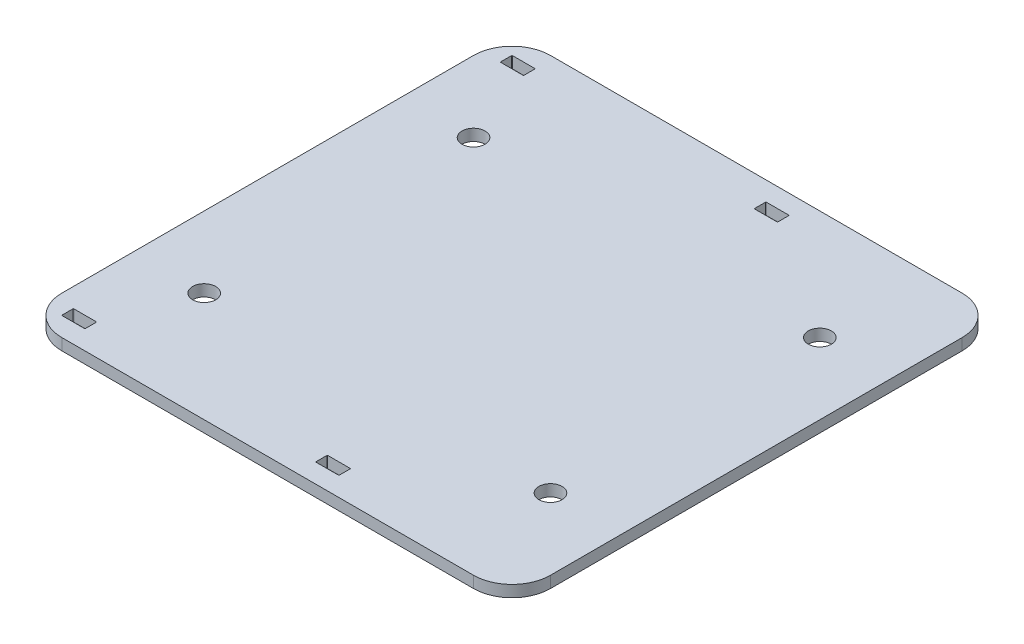
from build123d import *

# Parameters (mm, degrees)
SKETCH1_R           = 3
BOSS_EXTRUDE1_DEPTH = 3
CUT_EXTRUDE1_REACH  = 91.853
SKETCH2_W           = 6.05
SKETCH2_H           = 3.05
FILLET1_R           = 0.1


with BuildPart() as part:
    # Sketch1 → Boss-Extrude1 (new body)
    with BuildSketch(Plane(origin=(0, 0, 0), x_dir=(1, 0, 0), z_dir=(0, 1, 0))):
        with BuildLine():
            Line((-53.5, 63.5), (53.5, 63.5))
            ThreePointArc((53.5, 63.5), (60.571067812, 60.571067812), (63.5, 53.5))
            Line((63.5, 53.5), (63.5, -53.5))
            ThreePointArc((63.5, -53.5), (60.571067812, -60.571067812), (53.5, -63.5))
            Line((53.5, -63.5), (-53.5, -63.5))
            ThreePointArc((-53.5, -63.5), (-60.571067812, -60.571067812), (-63.5, -53.5))
            Line((-63.5, -53.5), (-63.5, 53.5))
            ThreePointArc((-63.5, 53.5), (-60.571067812, 60.571067812), (-53.5, 63.5))
        make_face()
        with Locations(Location((-45, 35, 0), (0, 0, 270))):
            Circle(SKETCH1_R, mode=Mode.SUBTRACT)
        with Locations(Location((45, 35, 0), (0, 0, 90))):
            Circle(SKETCH1_R, mode=Mode.SUBTRACT)
        with Locations(Location((45, -35, 0), (0, 0, 270))):
            Circle(SKETCH1_R, mode=Mode.SUBTRACT)
        with Locations(Location((-45, -35, 0), (0, 0, 90))):
            Circle(SKETCH1_R, mode=Mode.SUBTRACT)
    extrude(amount=BOSS_EXTRUDE1_DEPTH)

    # Sketch2 → Cut-Extrude1 (cut, up to next)
    with BuildSketch(Plane(origin=(0, 3, 0), x_dir=(1, 0, 0), z_dir=(0, 1, 0)), mode=Mode.PRIVATE) as cut_extrude1_sk1:
        with Locations((-55.5, -57)):
            Rectangle(SKETCH2_W, SKETCH2_H)
    cut_extrude1_tool1 = extrude(cut_extrude1_sk1.sketch, amount=-CUT_EXTRUDE1_REACH, mode=Mode.PRIVATE) & part.part
    # Sketch2 → Cut-Extrude1 (cut, up to next)
    with BuildSketch(Plane(origin=(0, 3, 0), x_dir=(1, 0, 0), z_dir=(0, 1, 0)), mode=Mode.PRIVATE) as cut_extrude1_sk2:
        with Locations((10.5, -57)):
            Rectangle(SKETCH2_W, SKETCH2_H)
    cut_extrude1_tool2 = extrude(cut_extrude1_sk2.sketch, amount=-CUT_EXTRUDE1_REACH, mode=Mode.PRIVATE) & part.part
    # Sketch2 → Cut-Extrude1 (cut, up to next)
    with BuildSketch(Plane(origin=(0, 3, 0), x_dir=(1, 0, 0), z_dir=(0, 1, 0)), mode=Mode.PRIVATE) as cut_extrude1_sk3:
        with Locations((10.5, 57)):
            Rectangle(SKETCH2_W, SKETCH2_H)
    cut_extrude1_tool3 = extrude(cut_extrude1_sk3.sketch, amount=-CUT_EXTRUDE1_REACH, mode=Mode.PRIVATE) & part.part
    # Sketch2 → Cut-Extrude1 (cut, up to next)
    with BuildSketch(Plane(origin=(0, 3, 0), x_dir=(1, 0, 0), z_dir=(0, 1, 0)), mode=Mode.PRIVATE) as cut_extrude1_sk4:
        with Locations((-55.5, 57)):
            Rectangle(SKETCH2_W, SKETCH2_H)
    cut_extrude1_tool4 = extrude(cut_extrude1_sk4.sketch, amount=-CUT_EXTRUDE1_REACH, mode=Mode.PRIVATE) & part.part
    add(cut_extrude1_tool1.solids().sort_by_distance((-55.5, 3, 57))[0], mode=Mode.SUBTRACT)
    add(cut_extrude1_tool2.solids().sort_by_distance((10.5, 3, 57))[0], mode=Mode.SUBTRACT)
    add(cut_extrude1_tool3.solids().sort_by_distance((10.5, 3, -57))[0], mode=Mode.SUBTRACT)
    add(cut_extrude1_tool4.solids().sort_by_distance((-55.5, 3, -57))[0], mode=Mode.SUBTRACT)

    # Fillet1
    fillet1_edges = [part.edges().sort_by_distance(p)[0] for p in [
        (13.525, 1.5, -58.525),
        (13.525, 1.5, -55.475),
        (7.475, 1.5, -55.475),
        (7.475, 1.5, -58.525),
        (-58.525, 1.5, 58.525),
        (-58.525, 1.5, 55.475),
        (-52.475, 1.5, 55.475),
        (-52.475, 1.5, 58.525),
        (13.525, 1.5, 55.475),
        (13.525, 1.5, 58.525),
        (7.475, 1.5, 58.525),
        (7.475, 1.5, 55.475),
        (-58.525, 1.5, -55.475),
        (-58.525, 1.5, -58.525),
        (-52.475, 1.5, -58.525),
        (-52.475, 1.5, -55.475),
    ]]
    fillet(fillet1_edges, radius=FILLET1_R)


solid = part.part
